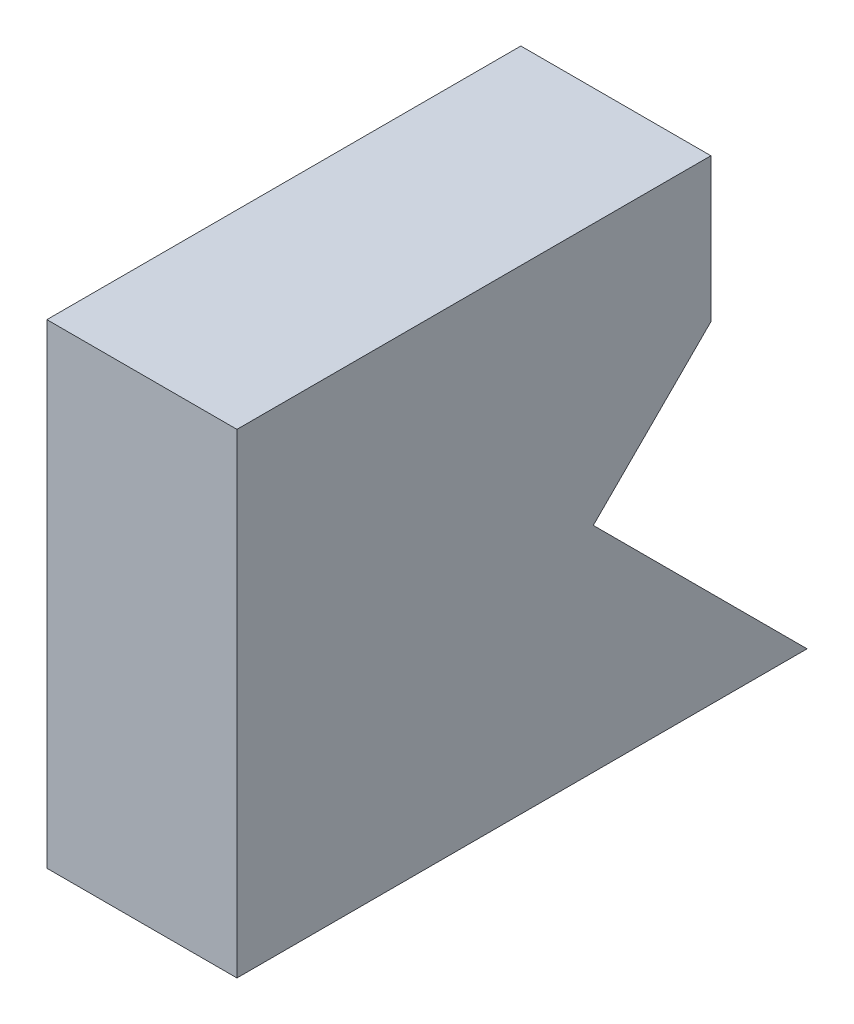
from build123d import *

# Parameters (mm, degrees)
BOSS_EXTRU_1_DEPTH = 40


with BuildPart() as part:
    # Esquisse1 → Boss.-Extru.1 (new body)
    with BuildSketch(Plane(origin=(0, 0, 0), x_dir=(0, 0, -1), z_dir=(1, 0, 0))):
        Polygon((0, 0), (-120, 0), (-120, 100), (-20.251262658, 100), (-20.251262658, 69.748737342), (-45, 45), align=None)
    extrude(amount=BOSS_EXTRU_1_DEPTH)


solid = part.part
